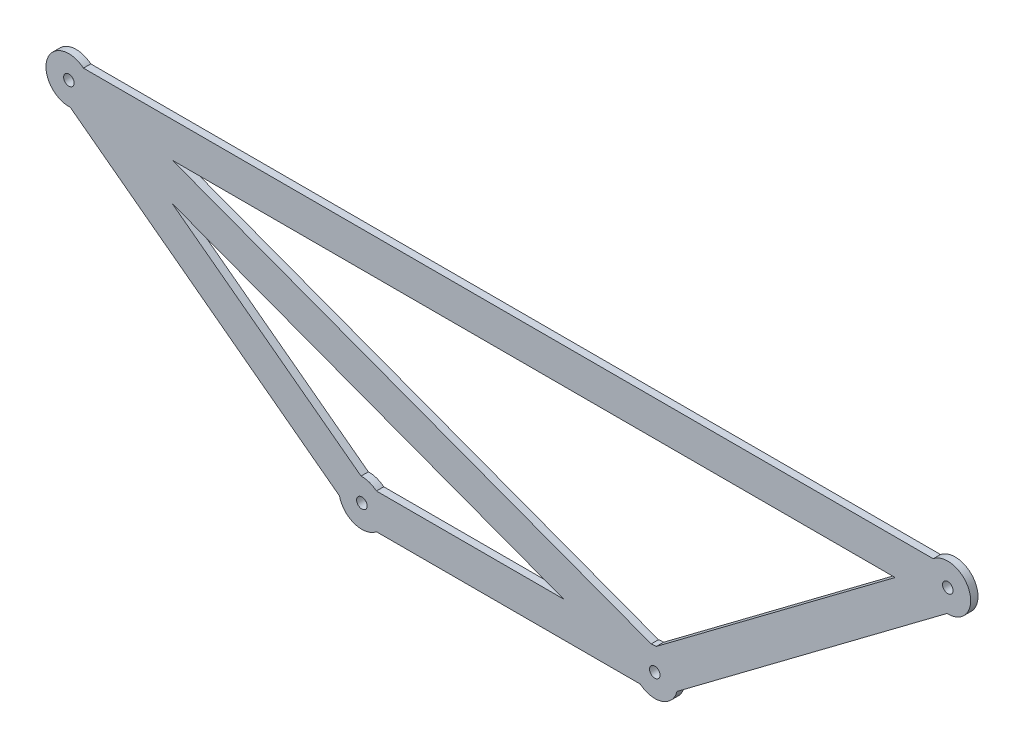
from build123d import *

# Parameters (mm, degrees)
SKETCH2_R           = 31.26
SKETCH2_W           = 400
SKETCH2_H           = 48.2
SKETCH2_W_2         = 1200
BOSS_EXTRUDE4_DEPTH = 10
SKETCH3_R           = 7.18
CUT_EXTRUDE1_DEPTH  = 10


with BuildPart() as part:
    # Sketch2 → Boss-Extrude4 (new body)
    with BuildSketch(Plane.XY):
        with Locations((400, -300)):
            Circle(SKETCH2_R)
        with Locations((800, -300)):
            Circle(SKETCH2_R)
        Circle(SKETCH2_R)
        with Locations((1200, 0)):
            Circle(SKETCH2_R)
        with Locations((600, -300)):
            Rectangle(SKETCH2_W, SKETCH2_H)
        with Locations((600, 0)):
            Rectangle(SKETCH2_W_2, SKETCH2_H)
        Polygon((414.610371201, -280.519505066), (14.610371201, 19.480494934), (-14.309628799, -19.079505066), (385.690371201, -319.079505066), align=None)
        Polygon((1185.687703452, 19.083062065), (785.687703452, -280.916937935), (814.607703452, -319.476937935), (1214.607703452, -19.476937935), align=None)
        Polygon((792.609480398, -319.708052273), (-7.390519602, -19.708052273), (9.533630282, 25.423014086), (809.533630282, -274.576985914), align=None)
    extrude(amount=BOSS_EXTRUDE4_DEPTH)

    # Sketch3 → Cut-Extrude1 (cut)
    with BuildSketch(Plane.XY.offset(10)):
        Circle(SKETCH3_R)
        with Locations((1200, 0)):
            Circle(SKETCH3_R)
        with Locations((800, -300)):
            Circle(SKETCH3_R)
        with Locations((400, -300)):
            Circle(SKETCH3_R)
    extrude(amount=-CUT_EXTRUDE1_DEPTH, mode=Mode.SUBTRACT)


solid = part.part
